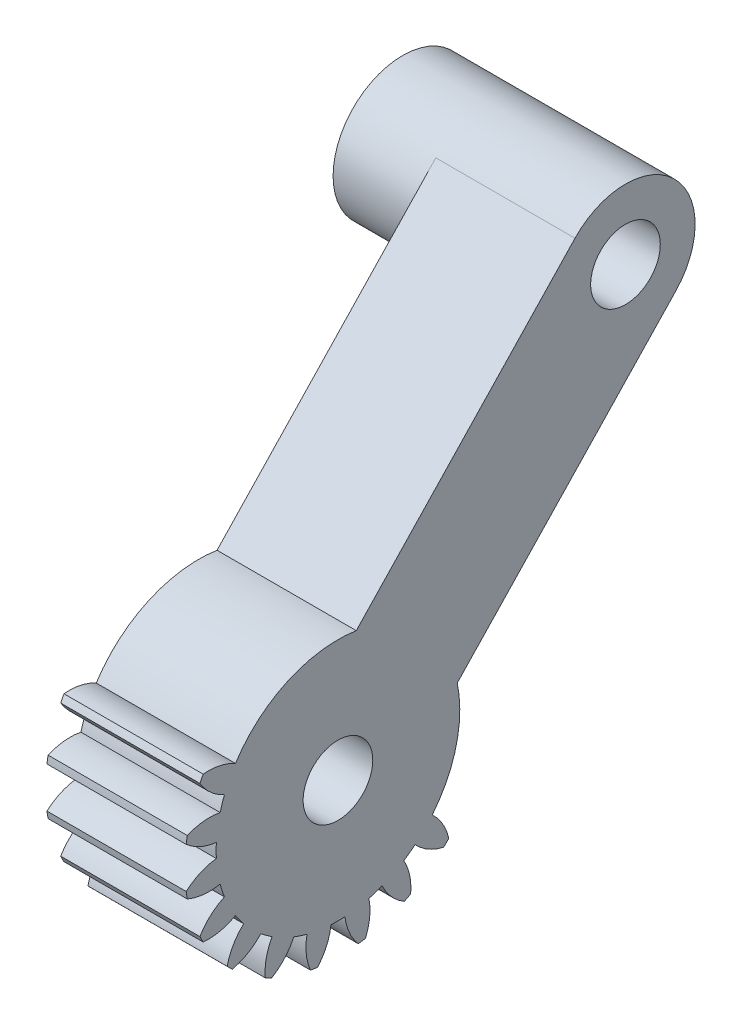
from build123d import *
from build123d.topology import SkipClean

# Parameters (mm, degrees)
SKETCH1_R           = 2.5
BOSS_EXTRUDE1_DEPTH = 10
SKETCH2_R           = 2.5
BOSS_EXTRUDE2_DEPTH = 10
SKETCH3_R           = 5
SKETCH3_R_2         = 2.5
BOSS_EXTRUDE3_DEPTH = 6
SKETCH4_R           = 2.5
CUT_EXTRUDE1_DEPTH  = 41.209967862
CUT_EXTRUDE2_DEPTH  = 41.209967862


with BuildPart() as part:
    # Sketch1 → Boss-Extrude1 (new body)
    with BuildSketch(Plane(origin=(4.043870029, 0, 0), x_dir=(0, 0, -1), z_dir=(1, 0, 0))):
        with BuildLine():
            ThreePointArc((-10.029541992, 0.342879069), (-9.019080639, -0.304016541), (-7.862233613, -0.622153359))
            ThreePointArc((-7.862233613, -0.622153359), (-7.876528296, -1.122077366), (-7.862233613, -1.622001374))
            ThreePointArc((-7.862233613, -1.622001374), (-9.019080639, -1.940138191), (-10.029541992, -2.587033801))
            ThreePointArc((-10.029541992, -2.587033801), (-9.992100042, -2.842856482), (-9.948655897, -3.097728508))
            ThreePointArc((-9.948655897, -3.097728508), (-8.787748306, -3.400713063), (-7.58921172, -3.345793765))
            ThreePointArc((-7.58921172, -3.345793765), (-7.448321757, -3.82566705), (-7.280241692, -4.296705735))
            ThreePointArc((-7.280241692, -4.296705735), (-8.282158911, -4.956757219), (-9.043263028, -5.884241235))
            ThreePointArc((-9.043263028, -5.884241235), (-8.928600062, -6.115972863), (-8.808522437, -6.344945585))
            ThreePointArc((-8.808522437, -6.344945585), (-7.610806331, -6.274360846), (-6.487901298, -5.851761317))
            ThreePointArc((-6.487901298, -5.851761317), (-6.20561798, -6.264610538), (-5.90020538, -6.660655353))
            ThreePointArc((-5.90020538, -6.660655353), (-6.649118154, -7.598011066), (-7.086362862, -8.715294889))
            ThreePointArc((-7.086362862, -8.715294889), (-6.905702889, -8.900251959), (-6.720745819, -9.080911932))
            ThreePointArc((-6.720745819, -9.080911932), (-5.603461996, -8.643667224), (-4.666106283, -7.89475445))
            ThreePointArc((-4.666106283, -7.89475445), (-4.270061468, -8.20016705), (-3.857212247, -8.482450368))
            ThreePointArc((-3.857212247, -8.482450368), (-4.279811776, -9.605355401), (-4.350396515, -10.803071507))
            ThreePointArc((-4.350396515, -10.803071507), (-4.121423793, -10.923149132), (-3.889692165, -11.037812099))
            ThreePointArc((-3.889692165, -11.037812099), (-2.962208149, -10.276707981), (-2.302156665, -9.274790762))
            ThreePointArc((-2.302156665, -9.274790762), (-1.83111798, -9.442870827), (-1.351244695, -9.583760791))
            ThreePointArc((-1.351244695, -9.583760791), (-1.406163992, -10.782297376), (-1.103179437, -11.943204968))
            ThreePointArc((-1.103179437, -11.943204968), (-0.848307411, -11.986649113), (-0.592484731, -12.024091063))
            ThreePointArc((-0.592484731, -12.024091063), (0.054410879, -11.01362971), (0.372547697, -9.856782684))
            ThreePointArc((0.372547697, -9.856782684), (0.872471704, -9.871077366), (1.372395712, -9.856782684))
            ThreePointArc((1.372395712, -9.856782684), (1.690532529, -11.01362971), (2.337428139, -12.024091063))
            ThreePointArc((2.337428139, -12.024091063), (2.59325082, -11.986649113), (2.848122846, -11.943204968))
            ThreePointArc((2.848122846, -11.943204968), (3.151107401, -10.782297376), (3.096188103, -9.583760791))
            ThreePointArc((3.096188103, -9.583760791), (3.576061388, -9.442870827), (4.047100073, -9.274790762))
            ThreePointArc((4.047100073, -9.274790762), (4.707151558, -10.276707981), (5.634635573, -11.037812099))
            ThreePointArc((5.634635573, -11.037812099), (5.866367201, -10.923149132), (6.095339923, -10.803071507))
            ThreePointArc((6.095339923, -10.803071507), (6.024755184, -9.605355401), (5.602155655, -8.482450368))
            ThreePointArc((5.602155655, -8.482450368), (6.015004877, -8.20016705), (6.411049691, -7.89475445))
            ThreePointArc((6.411049691, -7.89475445), (7.348405404, -8.643667224), (8.465689227, -9.080911932))
            ThreePointArc((8.465689227, -9.080911932), (8.650646297, -8.900251959), (8.83130627, -8.715294889))
            ThreePointArc((8.83130627, -8.715294889), (8.394061563, -7.598011066), (7.645148788, -6.660655353))
            ThreePointArc((7.645148788, -6.660655353), (7.950561388, -6.264610538), (8.232844706, -5.851761317))
            ThreePointArc((8.232844706, -5.851761317), (9.355749739, -6.274360846), (10.553465846, -6.344945585))
            ThreePointArc((10.553465846, -6.344945585), (10.67354347, -6.115972863), (10.788206437, -5.884241235))
            ThreePointArc((10.788206437, -5.884241235), (10.02710232, -4.956757219), (9.0251851, -4.296705735))
            ThreePointArc((9.0251851, -4.296705735), (9.193265165, -3.82566705), (9.334155129, -3.345793765))
            ThreePointArc((9.334155129, -3.345793765), (10.532691714, -3.400713063), (11.693599306, -3.097728508))
            ThreePointArc((11.693599306, -3.097728508), (11.737043451, -2.842856482), (11.774485401, -2.587033801))
            ThreePointArc((11.774485401, -2.587033801), (10.764024048, -1.940138191), (9.607177022, -1.622001374))
            ThreePointArc((9.607177022, -1.622001374), (9.621471704, -1.122077366), (9.607177022, -0.622153359))
            ThreePointArc((9.607177022, -0.622153359), (10.764024048, -0.304016541), (11.774485401, 0.342879069))
            ThreePointArc((11.774485401, 0.342879069), (11.737043451, 0.598701749), (11.693599306, 0.853573775))
            ThreePointArc((11.693599306, 0.853573775), (10.532691714, 1.156558331), (9.334155129, 1.101639033))
            ThreePointArc((9.334155129, 1.101639033), (9.193265165, 1.581512318), (9.0251851, 2.052551003))
            ThreePointArc((9.0251851, 2.052551003), (10.02710232, 2.712602487), (10.788206437, 3.640086503))
            ThreePointArc((10.788206437, 3.640086503), (10.67354347, 3.871818131), (10.553465846, 4.100790853))
            ThreePointArc((10.553465846, 4.100790853), (9.355749739, 4.030206114), (8.232844706, 3.607606585))
            ThreePointArc((8.232844706, 3.607606585), (7.950561388, 4.020455806), (7.645148788, 4.416500621))
            ThreePointArc((7.645148788, 4.416500621), (8.394061563, 5.353856334), (8.83130627, 6.471140157))
            ThreePointArc((8.83130627, 6.471140157), (8.650646297, 6.656097227), (8.465689227, 6.8367572))
            ThreePointArc((8.465689227, 6.8367572), (7.348405404, 6.399512492), (6.411049691, 5.650599718))
            ThreePointArc((6.411049691, 5.650599718), (6.015004877, 5.956012318), (5.602155655, 6.238295636))
            ThreePointArc((5.602155655, 6.238295636), (6.024755184, 7.361200669), (6.095339923, 8.558916775))
            ThreePointArc((6.095339923, 8.558916775), (5.866367201, 8.6789944), (5.634635573, 8.793657366))
            ThreePointArc((5.634635573, 8.793657366), (4.707151558, 8.032553249), (4.047100073, 7.03063603))
            ThreePointArc((4.047100073, 7.03063603), (3.576061388, 7.198716095), (3.096188103, 7.339606058))
            ThreePointArc((3.096188103, 7.339606058), (3.151107401, 8.538142644), (2.848122846, 9.699050235))
            ThreePointArc((2.848122846, 9.699050235), (2.59325082, 9.74249438), (2.337428139, 9.779936331))
            ThreePointArc((2.337428139, 9.779936331), (1.690532529, 8.769474978), (1.372395712, 7.612627952))
            ThreePointArc((1.372395712, 7.612627952), (0.872471704, 7.626922634), (0.372547697, 7.612627952))
            ThreePointArc((0.372547697, 7.612627952), (0.054410879, 8.769474978), (-0.592484731, 9.779936331))
            ThreePointArc((-0.592484731, 9.779936331), (-0.848307411, 9.74249438), (-1.103179437, 9.699050235))
            ThreePointArc((-1.103179437, 9.699050235), (-1.406163992, 8.538142644), (-1.351244695, 7.339606058))
            ThreePointArc((-1.351244695, 7.339606058), (-1.83111798, 7.198716095), (-2.302156665, 7.03063603))
            ThreePointArc((-2.302156665, 7.03063603), (-2.962208149, 8.032553249), (-3.889692165, 8.793657366))
            ThreePointArc((-3.889692165, 8.793657366), (-4.121423793, 8.6789944), (-4.350396515, 8.558916775))
            ThreePointArc((-4.350396515, 8.558916775), (-4.279811776, 7.361200669), (-3.857212247, 6.238295636))
            ThreePointArc((-3.857212247, 6.238295636), (-4.270061468, 5.956012318), (-4.666106283, 5.650599718))
            ThreePointArc((-4.666106283, 5.650599718), (-5.603461996, 6.399512492), (-6.720745819, 6.8367572))
            ThreePointArc((-6.720745819, 6.8367572), (-6.905702889, 6.656097227), (-7.086362862, 6.471140157))
            ThreePointArc((-7.086362862, 6.471140157), (-6.649118154, 5.353856334), (-5.90020538, 4.416500621))
            ThreePointArc((-5.90020538, 4.416500621), (-6.20561798, 4.020455806), (-6.487901298, 3.607606585))
            ThreePointArc((-6.487901298, 3.607606585), (-7.610806331, 4.030206114), (-8.808522437, 4.100790853))
            ThreePointArc((-8.808522437, 4.100790853), (-8.928600062, 3.871818131), (-9.043263028, 3.640086503))
            ThreePointArc((-9.043263028, 3.640086503), (-8.282158911, 2.712602487), (-7.280241692, 2.052551003))
            ThreePointArc((-7.280241692, 2.052551003), (-7.448321757, 1.581512318), (-7.58921172, 1.101639033))
            ThreePointArc((-7.58921172, 1.101639033), (-8.787748306, 1.156558331), (-9.948655897, 0.853573775))
            ThreePointArc((-9.948655897, 0.853573775), (-9.992100042, 0.598701749), (-10.029541992, 0.342879069))
        make_face()
        with Locations(Location((0.872471704, -1.122077366, 0), (0, 0, 180))):
            Circle(SKETCH1_R, mode=Mode.SUBTRACT)
    extrude(amount=-BOSS_EXTRUDE1_DEPTH)

    # Sketch2 → Boss-Extrude2 (add)
    with BuildSketch(Plane(origin=(4.043870029, 0, 0), x_dir=(0, 0, -1), z_dir=(1, 0, 0))):
        with BuildLine():
            Line((-2.754400151, 2.319695512), (17.89623712, 24.080926643))
            ThreePointArc((17.89623712, 24.080926643), (24.964881853, 24.266025619), (25.14998083, 17.197380886))
            Line((25.14998083, 17.197380886), (4.499343559, -4.563850245))
            ThreePointArc((4.499343559, -4.563850245), (-2.569301174, -4.748949221), (-2.754400151, 2.319695512))
        make_face()
        with Locations((21.523108975, 20.639153764)):
            Circle(SKETCH2_R, mode=Mode.SUBTRACT)
    extrude(amount=-BOSS_EXTRUDE2_DEPTH)

    # Sketch3 → Boss-Extrude3 (add)
    with BuildSketch(Plane.ZY.offset(5.956129971)):
        with Locations(Location((-21.523108975, 20.639153764, 0), (0, 0, 223.5))):
            Circle(SKETCH3_R)
        with Locations(Location((-21.523108975, 20.639153764, 0), (0, 0, 180))):
            Circle(SKETCH3_R_2, mode=Mode.SUBTRACT)
    extrude(amount=BOSS_EXTRUDE3_DEPTH)

    # Sketch4 → Cut-Extrude1 (cut, through all)
    with BuildSketch(Plane(origin=(4.043870029, 0, 0), x_dir=(0, 0, -1), z_dir=(1, 0, 0))):
        with Locations((0.872471704, -1.122077366)):
            Circle(SKETCH4_R)
    extrude(amount=-CUT_EXTRUDE1_DEPTH, mode=Mode.SUBTRACT)

    # Sketch6 → Cut-Extrude2 (cut, through all)
    with SkipClean():  # the faces are left unmerged after this step: merging them gives an invalid solid
        with BuildSketch(Plane(origin=(4.043870029, 0, 0), x_dir=(0, 0, -1), z_dir=(1, 0, 0))):
            with BuildLine():
                Line((4.579688985, 10.048212881), (2.187631015, 7.527509733))
                ThreePointArc((2.187631015, 7.527509733), (-2.46576826, 6.965020688), (-6.16100093, 4.08131227))
                Line((-6.16100093, 4.08131227), (-8.58915512, 5.877669916))
                ThreePointArc((-8.58915512, 5.877669916), (-2.68093011, 10.098091069), (4.579688985, 10.048212881))
            make_face()
            with BuildLine():
                Line((11.833432695, 3.164667124), (9.441374725, 0.643963976))
                ThreePointArc((9.441374725, 0.643963976), (9.424184018, -2.969566881), (7.948146758, -6.267932352))
                Line((7.948146758, -6.267932352), (10.39087042, -8.044427405))
                ThreePointArc((10.39087042, -8.044427405), (12.54560297, -2.624359175), (11.833432695, 3.164667124))
            make_face()
        extrude(amount=-CUT_EXTRUDE2_DEPTH, mode=Mode.SUBTRACT)


solid = part.part
